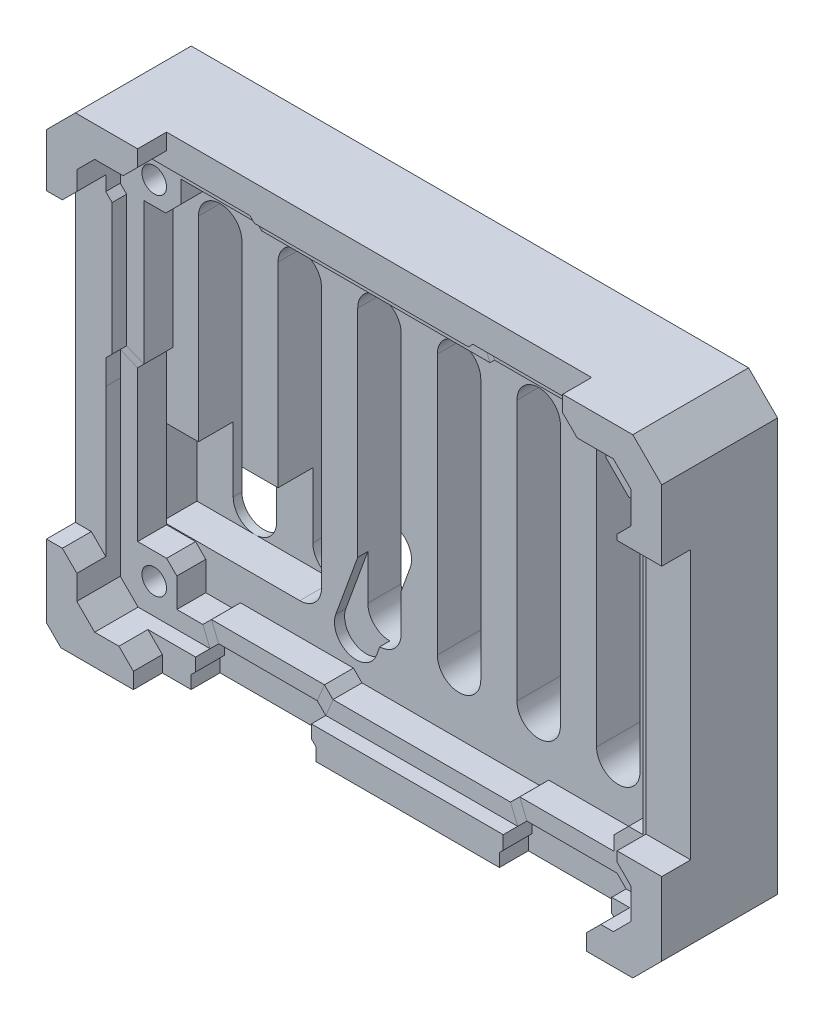
from build123d import *

# Parameters (mm, degrees)
SKETCH_1_W                = 75
SKETCH_1_H                = 55
EXTRUDE_1_DEPTH           = 12
SKETCH_2_R                = 1.7
CUT_EXTRUDE_1_DEPTH       = 12
CUT_EXTRUDE_START         = -4
SKETCH_3_W                = 5.6
SKETCH_3_H                = 5.6
CUT_EXTRUDE_2_DEPTH       = 2.5
SKETCH_5_W                = 85
SKETCH_5_H                = 65
SKETCH_5_W_2              = 75
SKETCH_5_H_2              = 55
EXTRUDE_2_DEPTH           = 12
CUT_EXTRUDE_3_DEPTH       = 2
SKETCH_8_W                = 0.8
SKETCH_8_H                = 2
CUT_EXTRUDE_4_DEPTH       = 4
SKETCH_12_W               = 1.6
SKETCH_12_H               = 4
CUT_EXTRUDE_5_DEPTH       = 1.4
EXTRUDE_3_DEPTH           = 4
SKETCH_16_R               = 1.7
CUT_EXTRUDE_6_DEPTH       = 4
CUT_EXTRUDE_7_DEPTH       = 6
CHAMFER_1_SIZE            = 4
CHAMFER_2_SIZE            = 2
CUT_EXTRUDE_8_DEPTH       = 4
EXTRUDE_4_DEPTH           = 4
CHAMFER_4_SIZE            = 2
CUT_EXTRUDE_10_DEPTH      = 3
CUT_EXTRUDE_10_DEPTH_BACK = 16
SKETCH_22_W               = 4.8
SKETCH_22_H               = 12
CUT_EXTRUDE_11_REACH      = 102.717


with BuildPart() as part:
    # 草图1 → 凸台-拉伸1 (new body)
    with BuildSketch(Plane.XY):
        with Locations((37.5, -27.5)):
            Rectangle(SKETCH_1_W, SKETCH_1_H)
    extrude(amount=EXTRUDE_1_DEPTH)

    # 草图2 → 切除-拉伸1 (cut)
    with BuildSketch(Plane(origin=(0, 0, 0), x_dir=(-1, 0, 0), z_dir=(0, 0, -1))):
        with Locations((-71.166921514, -3.557475235)):
            Circle(SKETCH_2_R)
        with Locations((-71.166921514, -51.58491491)):
            Circle(SKETCH_2_R)
        with Locations((-3.888803658, -51.58491491)):
            Circle(SKETCH_2_R)
        with Locations((-3.888803658, -3.557475235)):
            Circle(SKETCH_2_R)
    extrude(amount=-CUT_EXTRUDE_1_DEPTH, mode=Mode.SUBTRACT)

    # 草图3 → 切除-拉伸2 (cut)
    with BuildSketch(Plane(origin=(0, 0, 0), x_dir=(-1, 0, 0), z_dir=(0, 0, -1)).offset(CUT_EXTRUDE_START)):
        with Locations((-71.166921514, -3.557475235)):
            Rectangle(SKETCH_3_W, SKETCH_3_H)
        with Locations((-3.888803658, -3.557475235)):
            Rectangle(SKETCH_3_W, SKETCH_3_H)
        with Locations((-71.166921514, -51.58491491)):
            Rectangle(SKETCH_3_W, SKETCH_3_H)
        with Locations((-3.888803658, -51.58491491)):
            Rectangle(SKETCH_3_W, SKETCH_3_H)
    extrude(amount=CUT_EXTRUDE_2_DEPTH, mode=Mode.SUBTRACT)

    # 草图5 → 凸台-拉伸2 (add)
    with BuildSketch(Plane(origin=(0, 0, 0), x_dir=(-1, 0, 0), z_dir=(0, 0, -1))):
        with Locations((-37.5, -27.5)):
            Rectangle(SKETCH_5_W, SKETCH_5_H)
        with Locations((-37.5, -27.5)):
            Rectangle(SKETCH_5_W_2, SKETCH_5_H_2, mode=Mode.SUBTRACT)
    extrude(amount=-EXTRUDE_2_DEPTH)

    # 草图6 → 切除-拉伸3 (cut)
    with BuildSketch(Plane.XY.offset(12)):
        Polygon((0.871324699, -25.665782408), (0, -26.537107106), (0, -53.007434423), (1.992565577, -55), (11.269684867, -55), (12.461559563, -53.813385827), (26.743585303, -53.817105578), (27.926479725, -55), (53.772720173, -55), (55.043505207, -53.734475489), (68.152434681, -53.73819524), (69.414239441, -55), (72.982184232, -55), (74.974749809, -53.007434423), (74.974749809, -49.491704516), (73.028310897, -47.54000508), (73.032030648, -7.646889678), (74.974749809, -5.704170516), (74.974749809, -2.017856408), (72.982184232, -0.025290831), (50.245113202, -0.025290831), (49.61482093, -0.650322581), (19.394872914, -0.646602829), (18.773560915, -0.025290831), (1.992565577, -0.025290831), (0, -2.017856408), (0, -5.982633813), (0.87504445, -6.862938786), align=None)
    extrude(amount=-CUT_EXTRUDE_3_DEPTH, mode=Mode.SUBTRACT)

    # Sweep 1: sweep along a path in 草图7
    with BuildLine(Plane.XY.offset(10)) as sweep_1_path:
        Line((0.87504445, -6.862938786), (0.871324699, -25.665782408))
        Line((0.871324699, -25.665782408), (0, -26.537107106))
        Line((0, -26.537107106), (0, -53.007434423))
        Line((0, -53.007434423), (1.992565577, -55))
        Line((1.992565577, -55), (11.269684867, -55))
        Line((11.269684867, -55), (12.461559563, -53.813385827))
        Line((12.461559563, -53.813385827), (26.743585303, -53.817105578))
        Line((26.743585303, -53.817105578), (27.926479725, -55))
        Line((27.926479725, -55), (53.772720173, -55))
        Line((53.772720173, -55), (55.043505207, -53.734475489))
        Line((55.043505207, -53.734475489), (68.152434681, -53.73819524))
        Line((68.152434681, -53.73819524), (69.414239441, -55))
        Line((69.414239441, -55), (72.982184232, -55))
        Line((72.982184232, -55), (74.974749809, -53.007434423))
        Line((74.974749809, -53.007434423), (74.974749809, -49.491704516))
        Line((74.974749809, -49.491704516), (73.028310897, -47.54000508))
        Line((73.028310897, -47.54000508), (73.032030648, -7.646889678))
        Line((73.032030648, -7.646889678), (74.974749809, -5.704170516))
        Line((74.974749809, -5.704170516), (74.974749809, -2.017856408))
        Line((74.974749809, -2.017856408), (72.982184232, -0.025290831))
        Line((72.982184232, -0.025290831), (50.245113202, -0.025290831))
        Line((50.245113202, -0.025290831), (49.61482093, -0.650322581))
        Line((49.61482093, -0.650322581), (19.394872914, -0.646602829))
        Line((19.394872914, -0.646602829), (18.773560915, -0.025290831))
        Line((18.773560915, -0.025290831), (1.992565577, -0.025290831))
        Line((1.992565577, -0.025290831), (0, -2.017856408))
        Line((0, -2.017856408), (0, -5.982633813))
        Line((0, -5.982633813), (0.87504445, -6.862938786))
    # 草图8 → Sweep 1 (sweep, cut)
    with BuildSketch(Plane(origin=(47.466326748, -29.617285171, 16.834886136), x_dir=(1, 0, 0), z_dir=(0, 1, 0))):
        with Locations((-47.866326748, 5.834886136)):
            Rectangle(SKETCH_8_W, SKETCH_8_H)
    sweep(path=sweep_1_path.line, transition=Transition.RIGHT, mode=Mode.SUBTRACT)

    # 草图9 → 切除-拉伸4 (cut)
    with BuildSketch(Plane.XY.offset(10)):
        Polygon((0.871324699, -25.665782408), (0, -26.537107106), (0, -53.007434423), (1.992565577, -55), (11.269684867, -55), (12.461559563, -53.813385827), (26.743585303, -53.817105578), (27.926479725, -55), (53.772720173, -55), (55.043505207, -53.734475489), (68.152434681, -53.73819524), (69.414239441, -55), (72.982184232, -55), (74.974749809, -53.007434423), (74.974749809, -49.491704516), (73.028310897, -47.54000508), (73.032030648, -7.646889678), (74.974749809, -5.704170516), (74.974749809, -2.017856408), (72.982184232, -0.025290831), (50.245113202, -0.025290831), (49.61482093, -0.650322581), (19.394872914, -0.646602829), (18.773560915, -0.025290831), (1.992565577, -0.025290831), (0, -2.017856408), (0, -5.982633813), (0.87504445, -6.862938786), align=None)
    extrude(amount=-CUT_EXTRUDE_4_DEPTH, mode=Mode.SUBTRACT)

    # Sweep 1 2: sweep along a path in 草图10
    with BuildLine(Plane.XY.offset(6)) as sweep_1_2_path:
        Line((0.87504445, -6.862938786), (0.871324699, -25.665782408))
        Line((0.871324699, -25.665782408), (0, -26.537107106))
        Line((0, -26.537107106), (0, -53.007434423))
        Line((0, -53.007434423), (1.992565577, -55))
        Line((1.992565577, -55), (11.269684867, -55))
        Line((11.269684867, -55), (12.461559563, -53.813385827))
        Line((12.461559563, -53.813385827), (26.743585303, -53.817105578))
        Line((26.743585303, -53.817105578), (27.926479725, -55))
        Line((27.926479725, -55), (53.772720173, -55))
        Line((53.772720173, -55), (55.043505207, -53.734475489))
        Line((55.043505207, -53.734475489), (68.152434681, -53.73819524))
        Line((68.152434681, -53.73819524), (69.414239441, -55))
        Line((69.414239441, -55), (72.982184232, -55))
        Line((72.982184232, -55), (74.974749809, -53.007434423))
        Line((74.974749809, -53.007434423), (74.974749809, -49.491704516))
        Line((74.974749809, -49.491704516), (73.028310897, -47.54000508))
        Line((73.028310897, -47.54000508), (73.032030648, -7.646889678))
        Line((73.032030648, -7.646889678), (74.974749809, -5.704170516))
        Line((74.974749809, -5.704170516), (74.974749809, -2.017856408))
        Line((74.974749809, -2.017856408), (72.982184232, -0.025290831))
        Line((72.982184232, -0.025290831), (50.245113202, -0.025290831))
        Line((50.245113202, -0.025290831), (49.61482093, -0.650322581))
        Line((49.61482093, -0.650322581), (19.394872914, -0.646602829))
        Line((19.394872914, -0.646602829), (18.773560915, -0.025290831))
        Line((18.773560915, -0.025290831), (1.992565577, -0.025290831))
        Line((1.992565577, -0.025290831), (0, -2.017856408))
        Line((0, -2.017856408), (0, -5.982633813))
        Line((0, -5.982633813), (0.87504445, -6.862938786))
    # 草图12 → Sweep 1 2 (sweep)
    with BuildSketch(Plane(origin=(47.466326748, -29.617285171, 16.834886136), x_dir=(1, 0, 0), z_dir=(0, 1, 0))):
        with Locations((24.763844024, 8.834886136)):
            Rectangle(SKETCH_12_W, SKETCH_12_H)
    sweep(path=sweep_1_2_path.line, transition=Transition.RIGHT)

    # 草图13 → 切除-拉伸5 (cut)
    with BuildSketch(Plane.XY.offset(6)):
        with BuildLine():
            Line((35.258645106, -36.275856129), (30.607171274, -49.05567545))
            ThreePointArc((30.607171274, -49.05567545), (26.762032982, -50.848692882), (24.969015549, -47.00355459))
            Line((24.969015549, -47.00355459), (29.620489381, -34.223735269))
            ThreePointArc((29.620489381, -34.223735269), (33.465627674, -32.430717837), (35.258645106, -36.275856129))
        make_face()
    extrude(amount=-CUT_EXTRUDE_5_DEPTH, mode=Mode.SUBTRACT)

    # 草图15 → 凸台-拉伸3 (add)
    with BuildSketch(Plane.XY.offset(6)):
        Polygon((1.599811284, -47.985975153), (5.599811284, -47.985975153), (7.014024847, -49.400188716), (7.014024847, -53.400188716), (2.655229109, -53.400188716), (1.599811284, -52.344770891), align=None)
        Polygon((71.42844383, -48.138178454), (69.42844383, -48.138178454), (67.42844383, -50.138178454), (67.42844383, -52.138178454), (68.815286237, -52.13857198), (70.076902972, -53.400188716), (72.319520701, -53.400188716), (73.374938525, -52.344770891), (73.374938525, -50.153103724), (71.42843794, -48.201342449), align=None)
        Polygon((7.59619916, -1.625102115), (7.59619916, -4.625102115), (5.474878816, -6.746422459), (2.474878816, -6.746422459), (2.474986279, -6.203213329), (1.599811284, -5.322777027), (1.599811284, -2.680519939), (2.655229109, -1.625102115), align=None)
        Polygon((72.319520701, -1.625102115), (66.319520701, -1.625102115), (66.319520701, -5.625102115), (69.432117646, -8.73769906), (71.432117646, -8.73769906), (71.432281151, -6.984164359), (73.303483781, -5.112961729), (73.374938525, -5.041506985), (73.374938525, -2.680519939), align=None)
    extrude(amount=EXTRUDE_3_DEPTH)

    # 草图16 → 切除-拉伸6 (cut)
    with BuildSketch(Plane(origin=(0, 0, 6), x_dir=(-1, 0, 0), z_dir=(0, 0, -1))):
        with Locations((-3.888803658, -51.58491491)):
            Circle(SKETCH_16_R)
        with Locations((-71.166921514, -51.58491491)):
            Circle(SKETCH_16_R)
        with Locations((-71.166921514, -3.557475235)):
            Circle(SKETCH_16_R)
        with Locations((-3.888803658, -3.557475235)):
            Circle(SKETCH_16_R)
    extrude(amount=-CUT_EXTRUDE_6_DEPTH, mode=Mode.SUBTRACT)

    # 草图17 → 切除-拉伸7 (cut)
    with BuildSketch(Plane.XY.offset(6)):
        with BuildLine():
            Line((12, -8.852281976), (12, -44.852281976))
            ThreePointArc((12, -44.852281976), (9, -47.852281976), (6, -44.852281976))
            Line((6, -44.852281976), (6, -8.852281976))
            ThreePointArc((6, -8.852281976), (9, -5.852281976), (12, -8.852281976))
        make_face()
        with BuildLine():
            Line((23, -8.852281976), (23, -44.852281976))
            ThreePointArc((23, -44.852281976), (20, -47.852281976), (17, -44.852281976))
            Line((17, -44.852281976), (17, -8.852281976))
            ThreePointArc((17, -8.852281976), (20, -5.852281976), (23, -8.852281976))
        make_face()
        with BuildLine():
            Line((34, -8.852281976), (34, -44.852281976))
            ThreePointArc((34, -44.852281976), (31, -47.852281976), (28, -44.852281976))
            Line((28, -44.852281976), (28, -8.852281976))
            ThreePointArc((28, -8.852281976), (31, -5.852281976), (34, -8.852281976))
        make_face()
        with BuildLine():
            Line((45, -8.852281976), (45, -44.852281976))
            ThreePointArc((45, -44.852281976), (42, -47.852281976), (39, -44.852281976))
            Line((39, -44.852281976), (39, -8.852281976))
            ThreePointArc((39, -8.852281976), (42, -5.852281976), (45, -8.852281976))
        make_face()
        with BuildLine():
            Line((56, -8.852281976), (56, -44.852281976))
            ThreePointArc((56, -44.852281976), (53, -47.852281976), (50, -44.852281976))
            Line((50, -44.852281976), (50, -8.852281976))
            ThreePointArc((50, -8.852281976), (53, -5.852281976), (56, -8.852281976))
        make_face()
        with BuildLine():
            Line((67, -8.852281976), (67, -44.852281976))
            ThreePointArc((67, -44.852281976), (64, -47.852281976), (61, -44.852281976))
            Line((61, -44.852281976), (61, -8.852281976))
            ThreePointArc((61, -8.852281976), (64, -5.852281976), (67, -8.852281976))
        make_face()
    extrude(amount=-CUT_EXTRUDE_7_DEPTH, mode=Mode.SUBTRACT)

    # 倒角1
    chamfer_1_edges = [part.edges().sort_by_distance(p)[0] for p in [
        (-5, 5, 6),
        (80, -60, 6),
        (80, 5, 6),
    ]]
    chamfer(chamfer_1_edges, length=CHAMFER_1_SIZE)

    # 倒角2
    chamfer_2_edges = [part.edges().sort_by_distance(p)[0] for p in [
        (-5, -60, 6),
    ]]
    chamfer(chamfer_2_edges, length=CHAMFER_2_SIZE)

    # 草图18 → 切除-拉伸8 (cut)
    with BuildSketch(Plane.XY.offset(12)):
        Polygon((26.412128153, -56.4), (12.791807996, -56.4), (10.991807996, -58.2), (10.991807996, -60), (28.212128153, -60), (28.212128153, -58.2), align=None)
        Polygon((53.57381035, -58.2), (53.57381035, -60), (69.580957304, -60), (69.580957304, -58.2), (67.780957304, -56.4), (55.37381035, -56.4), align=None)
    extrude(amount=-CUT_EXTRUDE_8_DEPTH, mode=Mode.SUBTRACT)

    # 草图20 → 凸台-拉伸4 (add)
    with BuildSketch(Plane.XY.offset(12)):
        Polygon((-5, -6.312601125), (-0.8, -6.312601125), (-0.8, -1.686485558), (1.661194727, 0.774709169), (7.59619916, 0.774709169), (7.59619916, 5), (-1, 5), (-5, 1), align=None)
        Polygon((-0.8, -47.985975153), (-5, -47.985975153), (-5, -58), (-3, -60), (7.014024847, -60), (7.014024847, -55.8), (1.661194727, -55.8), (-0.8, -53.338805273), align=None)
        Polygon((76, 5), (66.319520701, 5), (66.319520701, 0.774709169), (73.313555082, 0.774709169), (75.774749809, -1.686485558), (75.774749809, -6.035541366), (73.831999751, -7.978291425), (73.831928941, -8.73769906), (80, -8.73769906), (80, 1), align=None)
        Polygon((80, -56), (80, -45.869766166), (73.828466638, -45.869766166), (73.828341736, -47.209297389), (75.774749809, -49.160965902), (75.774749809, -53.338805273), (73.313555082, -55.8), (69.580957304, -55.8), (69.580957304, -60), (76, -60), align=None)
    extrude(amount=EXTRUDE_4_DEPTH)

    # 倒角4
    chamfer_4_edges = [part.edges().sort_by_distance(p)[0] for p in [
        (-0.8, -47.985975153, 14),
        (7.014024847, -55.8, 14),
        (7.59619916, 0.774709169, 14),
        (-0.8, -6.312601125, 14),
        (66.319520701, 0.774709169, 14),
        (69.580957304, -55.8, 14),
    ]]
    chamfer(chamfer_4_edges, length=CHAMFER_4_SIZE)

    # 草图22 → 切除-拉伸10 (cut, two sides: drawn at the far end of the back side and taken through both)
    with BuildSketch(Plane(origin=(17, 0, 0), x_dir=(0, 0, -1), z_dir=(1, 0, 0)).offset(-CUT_EXTRUDE_10_DEPTH_BACK)):
        with Locations((-3.6, -41.852281976)):
            Rectangle(SKETCH_22_W, SKETCH_22_H)
    extrude(amount=CUT_EXTRUDE_10_DEPTH + CUT_EXTRUDE_10_DEPTH_BACK, mode=Mode.SUBTRACT)

    # 切除-拉伸11: up to this face of the body (flat: up to its plane)
    cut_extrude_11_end = Plane(part.part.faces().sort_by_distance((19.601968074, -58.266175172, 8))[0])
    # 草图23 → 切除-拉伸11 (cut, up to the picked face)
    with BuildSketch(Plane.XY.offset(12), mode=Mode.PRIVATE) as cut_extrude_11_sk1:
        Polygon((12.791807996, -54.613471867), (11.600019722, -55.8), (11.600019722, -57.591788274), (12.791807996, -56.4), (26.412128153, -56.4), (27.595108875, -57.582980723), (27.595108875, -55.8), (26.412128153, -54.617019277), align=None)
    cut_extrude_11_tool1 = split(extrude(cut_extrude_11_sk1.sketch, amount=-CUT_EXTRUDE_11_REACH, mode=Mode.PRIVATE), bisect_by=cut_extrude_11_end, keep=Keep.BOTH, mode=Mode.PRIVATE)
    # 草图23 → 切除-拉伸11 (cut, up to the picked face)
    with BuildSketch(Plane.XY.offset(12), mode=Mode.PRIVATE) as cut_extrude_11_sk2:
        Polygon((55.37381035, -54.534569248), (54.103119465, -55.8), (54.103119465, -57.670690885), (55.37381035, -56.4), (67.780957304, -56.4), (69.082868591, -57.701911287), (69.082868591, -55.8), (67.820969808, -54.538101217), align=None)
    cut_extrude_11_tool2 = split(extrude(cut_extrude_11_sk2.sketch, amount=-CUT_EXTRUDE_11_REACH, mode=Mode.PRIVATE), bisect_by=cut_extrude_11_end, keep=Keep.BOTH, mode=Mode.PRIVATE)
    add(cut_extrude_11_tool1.solids().sort_by(Axis((19.593717, -55.595748, 12), (0, 0, -1)))[0], mode=Mode.SUBTRACT)
    add(cut_extrude_11_tool2.solids().sort_by(Axis((61.601982, -55.577878, 12), (0, 0, -1)))[0], mode=Mode.SUBTRACT)


solid = part.part
